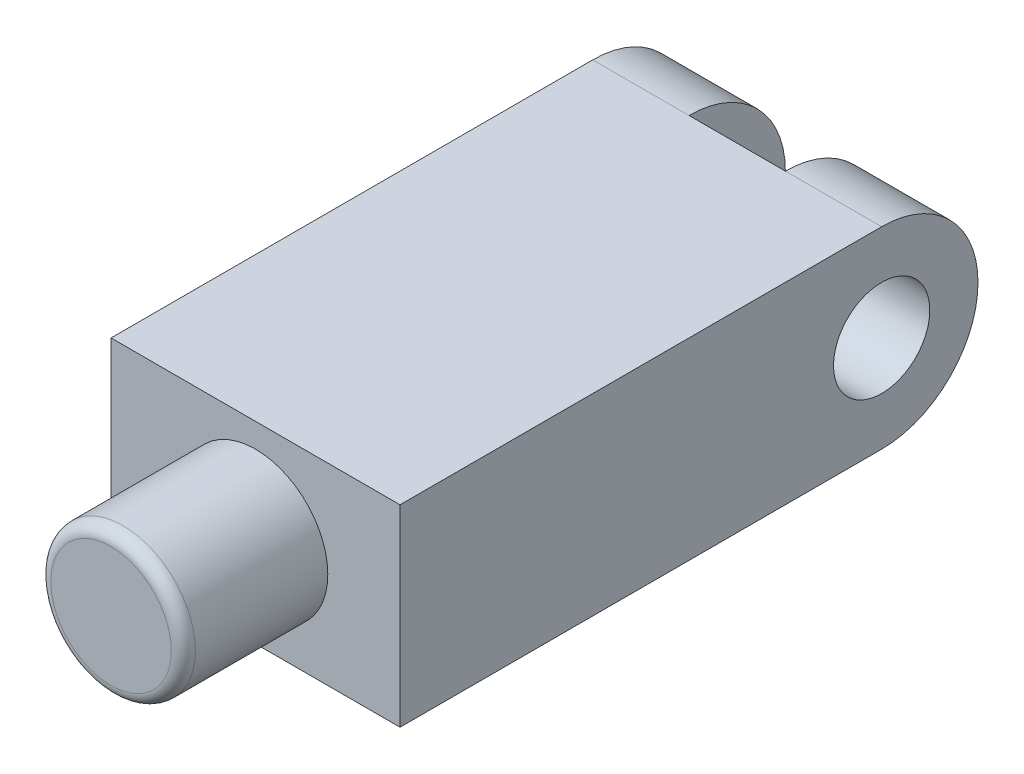
from build123d import *

# Parameters (mm, degrees)
SKETCH_1_W               = 60
SKETCH_1_H               = 40
EXTRUDE_1_DEPTH          = 100
SKETCH_6_R               = 20
EXTRUDE_2_DEPTH          = 20
EXTRUDE_START            = -20
SKETCH_7_R               = 20
EXTRUDE_3_DEPTH          = 20
CUT_EXTRUDE_1_DEPTH      = 120.268604419
CUT_EXTRUDE_1_DEPTH_BACK = 120.268604419
SKETCH_8_R               = 10
SKETCH_9_R               = 20
CUT_EXTRUDE_2_DEPTH      = 20
SKETCH_10_R              = 15
EXTRUDE_4_DEPTH          = 30
FILLET_1_R               = 2.5


with BuildPart() as part:
    # 스케치1 → 보스-돌출1 (new body)
    with BuildSketch(Plane.XY):
        with Locations((20, 5)):
            Rectangle(SKETCH_1_W, SKETCH_1_H)
    extrude(amount=EXTRUDE_1_DEPTH)

    # 스케치6 → 보스-돌출2 (add)
    with BuildSketch(Plane(origin=(50, 0, 0), x_dir=(0, 0, -1), z_dir=(1, 0, 0))):
        with Locations((0, 5)):
            Circle(SKETCH_6_R)
    extrude(amount=-EXTRUDE_2_DEPTH)

    # 스케치7 → 보스-돌출3 (add)
    with BuildSketch(Plane.ZY.offset(10).offset(EXTRUDE_START)):
        with Locations((0, 5)):
            Circle(SKETCH_7_R)
    extrude(amount=EXTRUDE_3_DEPTH)

    # 스케치8 → 컷-돌출1 (cut, two sides: drawn at the far end of the back side and taken through both)
    with BuildSketch(Plane.ZY.offset(10).offset(-CUT_EXTRUDE_1_DEPTH_BACK)):
        with Locations((0, 5)):
            Circle(SKETCH_8_R)
    extrude(amount=CUT_EXTRUDE_1_DEPTH + CUT_EXTRUDE_1_DEPTH_BACK, mode=Mode.SUBTRACT)

    # 스케치9 → 컷-돌출2 (cut)
    with BuildSketch(Plane.ZY.offset(-30)):
        with Locations((0, 5)):
            Circle(SKETCH_9_R)
    extrude(amount=CUT_EXTRUDE_2_DEPTH, mode=Mode.SUBTRACT)

    # 스케치10 → 보스-돌출4 (add)
    with BuildSketch(Plane.XY.offset(100)):
        with Locations((20, 5)):
            Circle(SKETCH_10_R)
    extrude(amount=EXTRUDE_4_DEPTH)

    # 필렛1
    fillet_1_edges = [part.edges().sort_by_distance(p)[0] for p in [
        (5, 5, 130),
    ]]
    fillet(fillet_1_edges, radius=FILLET_1_R)


solid = part.part
